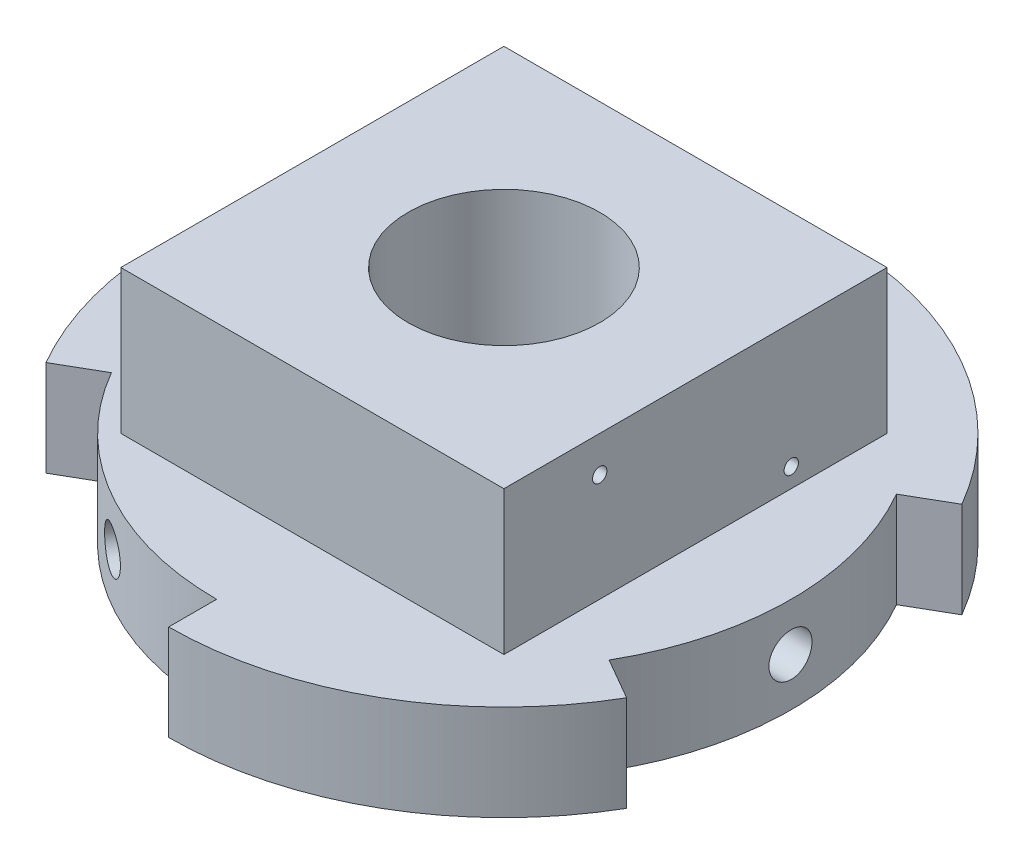
from build123d import *

# Parameters (mm, degrees)
SKETCH1_R           = 30
BOSS_EXTRUDE3_DEPTH = 10
SKETCH2_R           = 2.25
CUT_EXTRUDE1_DEPTH  = 25
CIRPATTERN1_COUNT   = 3
SKETCH3_W           = 40
SKETCH3_H           = 40
BOSS_EXTRUDE4_DEPTH = 15
SKETCH5_R           = 10
CUT_EXTRUDE5_DEPTH  = 25
SKETCH4_R           = 0.75
CUT_EXTRUDE6_DEPTH  = 6
CIRPATTERN2_COUNT   = 2


with BuildPart() as part:
    # Sketch1 → Boss-Extrude3 (new body)
    with BuildSketch(Plane(origin=(0, 0, 0), x_dir=(1, 0, 0), z_dir=(0, 1, 0))):
        with BuildLine():
            Line((-25.980762114, 15), (-30.310889132, 17.5))
            ThreePointArc((-30.310889132, 17.5), (-35, 0), (-30.310889132, -17.5))
            Line((-30.310889132, -17.5), (-25.980762114, -15))
            ThreePointArc((-25.980762114, -15), (-30, 0), (-25.980762114, 15))
        make_face()
        Circle(SKETCH1_R)
        with BuildLine():
            Line((0, 35), (0, 30))
            ThreePointArc((0, 30), (15, 25.980762114), (25.980762114, 15))
            Line((25.980762114, 15), (30.310889132, 17.5))
            ThreePointArc((30.310889132, 17.5), (17.5, 30.310889132), (0, 35))
        make_face()
        with BuildLine():
            ThreePointArc((25.980762114, -15), (15, -25.980762114), (0, -30))
            Line((0, -30), (0, -35))
            ThreePointArc((0, -35), (17.5, -30.310889132), (30.310889132, -17.5))
            Line((30.310889132, -17.5), (25.980762114, -15))
        make_face()
    extrude(amount=BOSS_EXTRUDE3_DEPTH)

    # Sketch2 → Cut-Extrude1 (cut)
    with BuildSketch(Plane(origin=(40, 0, 0), x_dir=(0, 0, -1), z_dir=(1, 0, 0))):
        with Locations((0, 5)):
            Circle(SKETCH2_R)
    cut_extrude1 = extrude(amount=-CUT_EXTRUDE1_DEPTH, mode=Mode.SUBTRACT)

    # CirPattern1: Cut-Extrude1 ×3 about axis
    cirpattern1_axis = Axis((0, 0, 0), (0, 1, 0))
    for i in range(1, CIRPATTERN1_COUNT):
        add(cut_extrude1.rotate(cirpattern1_axis, i * 360 / CIRPATTERN1_COUNT), mode=Mode.SUBTRACT)

    # Sketch3 → Boss-Extrude4 (add)
    with BuildSketch(Plane(origin=(0, 10, 0), x_dir=(1, 0, 0), z_dir=(0, 1, 0))):
        Rectangle(SKETCH3_W, SKETCH3_H)
    extrude(amount=BOSS_EXTRUDE4_DEPTH)

    # Sketch5 → Cut-Extrude5 (cut)
    with BuildSketch(Plane(origin=(0, 25, 0), x_dir=(1, 0, 0), z_dir=(0, 1, 0))):
        with Locations(Location((0, 0, 0), (0, 0, 270))):
            Circle(SKETCH5_R)
    extrude(amount=-CUT_EXTRUDE5_DEPTH, mode=Mode.SUBTRACT)

    # Sketch4 → Cut-Extrude6 (cut)
    with BuildSketch(Plane(origin=(20, 0, 0), x_dir=(0, 0, -1), z_dir=(1, 0, 0))):
        with Locations((-10, 21.25)):
            Circle(SKETCH4_R)
        with Locations((10, 12)):
            Circle(SKETCH4_R)
    cut_extrude6 = extrude(amount=-CUT_EXTRUDE6_DEPTH, mode=Mode.SUBTRACT)

    # CirPattern2: Cut-Extrude6 ×2 about axis
    cirpattern2_axis = Axis((0, -28.284271247, 0), (0, 1, 0))
    for i in range(1, CIRPATTERN2_COUNT):
        add(cut_extrude6.rotate(cirpattern2_axis, i * 360 / CIRPATTERN2_COUNT), mode=Mode.SUBTRACT)


solid = part.part
